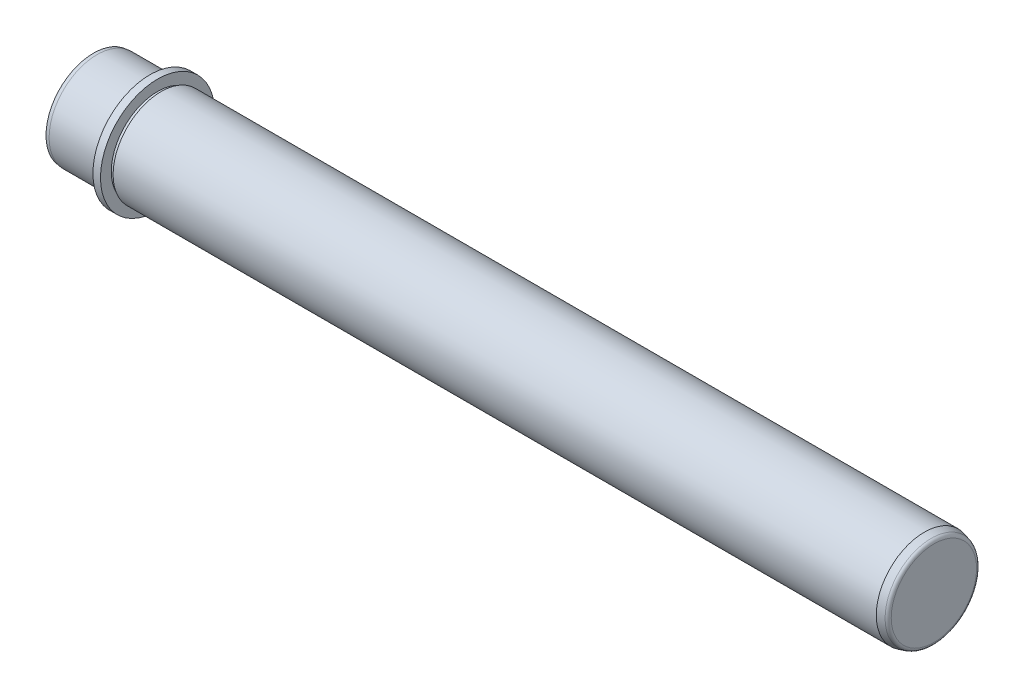
from build123d import *

# Parameters (mm, degrees)
OTW_R_GWINTOWANY_M12X1_51_D           = 10.5
OTW_R_GWINTOWANY_M12X1_51_DEPTH       = 31.5
OTW_R_GWINTOWANY_M12X1_51_CSINK_D     = 12.05
OTW_R_GWINTOWANY_M12X1_51_CSINK_ANGLE = 90
OTW_R_GWINTOWANY_M12X1_51_TIP         = 3.15451825


with BuildPart() as part:
    # Sketch1 → Base-Revolve (revolve)
    with BuildSketch(Plane.XY, mode=Mode.PRIVATE) as base_revolve_sk:
        with BuildLine():
            Line((-22.233400605, 40), (18.766599395, 40))
            Line((18.766599395, 40), (18.766599395, 38.5))
            Line((18.766599395, 38.5), (21.766599395, 38.5))
            Line((21.766599395, 38.5), (21.766599395, 47.5))
            Line((21.766599395, 47.5), (28.066599395, 47.5))
            Line((28.066599395, 47.5), (28.066599395, 38.5))
            Line((28.066599395, 38.5), (31.066599395, 38.5))
            Line((31.066599395, 38.5), (31.066599395, 40))
            Line((31.066599395, 40), (666.766599395, 40))
            Line((666.766599395, 40), (672.54305653, 38.452202975))
            ThreePointArc((672.54305653, 38.452202975), (674.146659415, 37.380709784), (674.766599395, 35.554425497))
            Line((674.766599395, 35.554425497), (674.766599395, 0))
            Line((674.766599395, 0), (-25.233400605, 0))
            Line((-25.233400605, 0), (-25.233400605, 39.578377496))
            Line((-25.233400605, 39.578377496), (-22.233400605, 40))
        make_face()
    revolve(base_revolve_sk.sketch.rotate(Axis((-25.233400605, 0, 0), (1, 0, 0)), 90), axis=Axis((-25.233400605, 0, 0), (1, 0, 0)))

    # Otwór gwintowany M12x1.51
    with Locations(Plane.ZY.offset(25.233400605)):
        with Locations((0, 0)):
            CounterSinkHole(OTW_R_GWINTOWANY_M12X1_51_D / 2, OTW_R_GWINTOWANY_M12X1_51_CSINK_D / 2, depth=OTW_R_GWINTOWANY_M12X1_51_DEPTH, counter_sink_angle=OTW_R_GWINTOWANY_M12X1_51_CSINK_ANGLE)
            with Locations((0, 0, -(OTW_R_GWINTOWANY_M12X1_51_DEPTH + OTW_R_GWINTOWANY_M12X1_51_TIP / 2))):  # 118° drill point
                Cone(0, OTW_R_GWINTOWANY_M12X1_51_D / 2, OTW_R_GWINTOWANY_M12X1_51_TIP, mode=Mode.SUBTRACT)


solid = part.part
